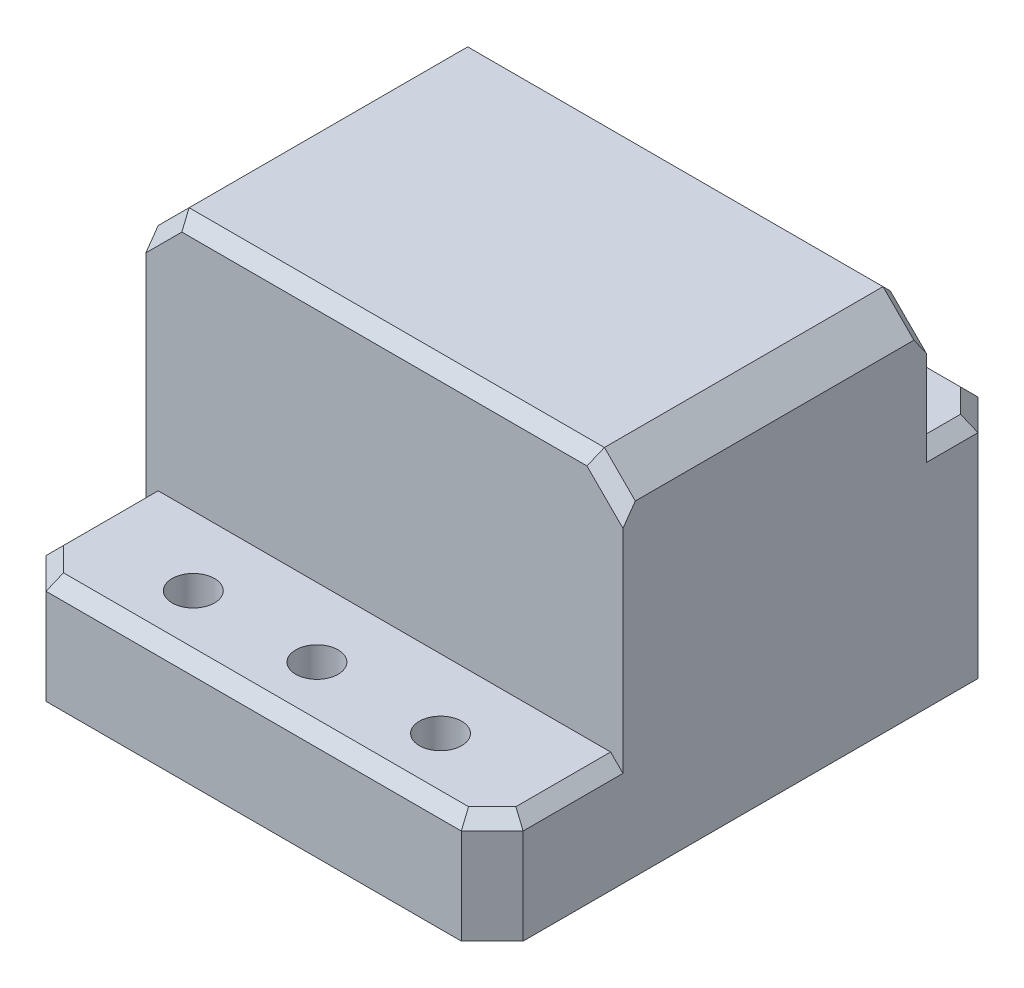
from build123d import *

# Parameters (mm, degrees)
BOSS_EXTRUDE1_DEPTH = 49.022
CHAMFER4_SIZE       = 3.175
CHAMFER5_SIZE       = 3.175
CHAMFER6_SIZE       = 3.175
SKETCH4_R           = 2.178410544
CUT_EXTRUDE1_DEPTH  = 5.08
CHAMFER7_SIZE       = 1.27
CHAMFER8_SIZE       = 1.27
CHAMFER9_SIZE       = 1.27


with BuildPart() as part:
    # Sketch1 → Boss-Extrude1 (new body)
    with BuildSketch(Plane(origin=(0, 0, 0), x_dir=(0, 0, -1), z_dir=(1, 0, 0))):
        Polygon((19.343076923, 8.689730769), (27.832538462, 8.689730769), (27.832538462, -14.453576923), (-25.253461538, -14.453576923), (-25.253461538, -3.385038462), (-11.820769231, -3.385038462), (-11.820769231, 22.122423077), (19.343076923, 22.122423077), align=None)
    extrude(amount=BOSS_EXTRUDE1_DEPTH)

    # Chamfer4
    chamfer4_edges = [part.edges().sort_by_distance(p)[0] for p in [
        (0, 22.122423077, -3.761153846),
    ]]
    chamfer(chamfer4_edges, length=CHAMFER4_SIZE)

    # Chamfer5
    chamfer5_edges = [part.edges().sort_by_distance(p)[0] for p in [
        (49.022, 22.122423077, -3.761153846),
    ]]
    chamfer(chamfer5_edges, length=CHAMFER5_SIZE)

    # Chamfer6
    chamfer6_edges = [part.edges().sort_by_distance(p)[0] for p in [
        (0, -2.881923077, -27.832538462),
        (0, -8.919307692, 25.253461538),
        (49.022, -2.881923077, -27.832538462),
        (49.022, -8.919307692, 25.253461538),
    ]]
    chamfer(chamfer6_edges, length=CHAMFER6_SIZE)

    # Sketch4 → Cut-Extrude1 (cut)
    with BuildSketch(Plane(origin=(0, -3.385038462, 0), x_dir=(1, 0, 0), z_dir=(0, 1, 0))):
        with Locations(Location((24.66531327, -18.90809717, 0), (0, 0, 270))):
            Circle(SKETCH4_R)
        with Locations(Location((37.36531327, -18.90809717, 0), (0, 0, 270))):
            Circle(SKETCH4_R)
        with Locations(Location((11.96531327, -18.90809717, 0), (0, 0, 270))):
            Circle(SKETCH4_R)
    extrude(amount=-CUT_EXTRUDE1_DEPTH, mode=Mode.SUBTRACT)

    # Chamfer7
    chamfer7_edges = [part.edges().sort_by_distance(p)[0] for p in [
        (49.022, 8.689730769, -22.000307692),
        (0, 8.689730769, -22.000307692),
        (24.511, 8.689730769, -27.832538462),
        (1.5875, 8.689730769, -26.245038462),
        (47.4345, 8.689730769, -26.245038462),
    ]]
    chamfer(chamfer7_edges, length=CHAMFER7_SIZE)

    # Chamfer8
    chamfer8_edges = [part.edges().sort_by_distance(p)[0] for p in [
        (0, -3.385038462, 16.949615385),
        (49.022, -3.385038462, 16.949615385),
        (24.511, -3.385038462, 25.253461538),
        (1.5875, -3.385038462, 23.665961538),
        (47.4345, -3.385038462, 23.665961538),
    ]]
    chamfer(chamfer8_edges, length=CHAMFER8_SIZE)

    # Chamfer9
    chamfer9_edges = [part.edges().sort_by_distance(p)[0] for p in [
        (1.5875, 20.534923077, 11.820769231),
        (1.5875, 20.534923077, -19.343076923),
        (24.511, 22.122423077, 11.820769231),
        (47.4345, 20.534923077, 11.820769231),
        (24.511, 22.122423077, -19.343076923),
        (47.4345, 20.534923077, -19.343076923),
    ]]
    chamfer(chamfer9_edges, length=CHAMFER9_SIZE)


solid = part.part
